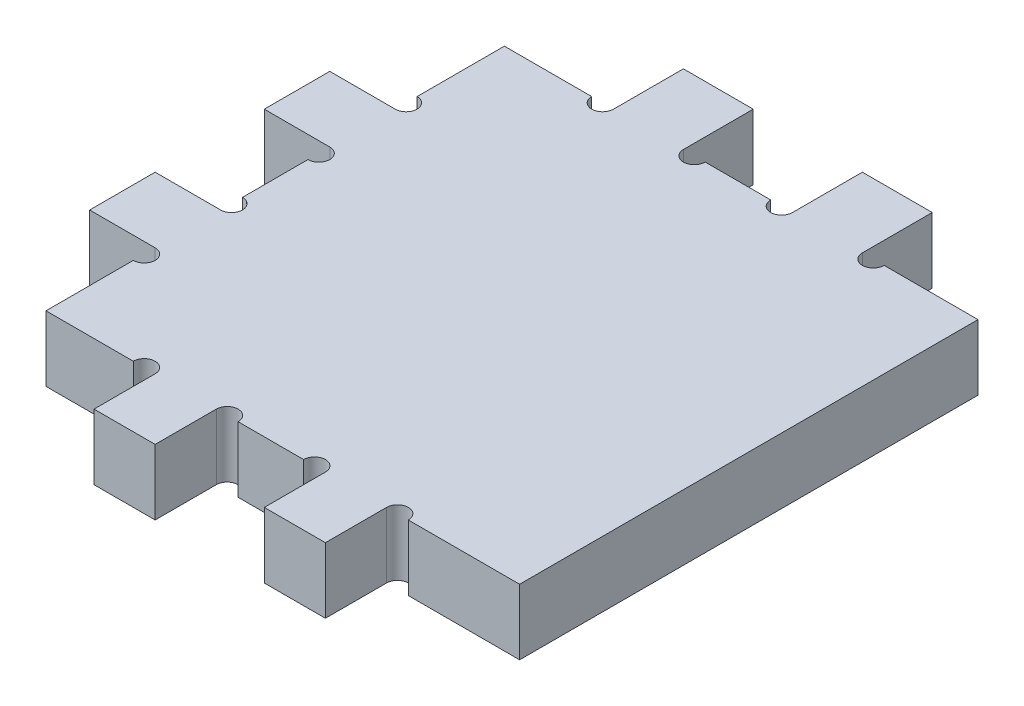
from build123d import *

# Parameters (mm, degrees)
BOSS_EXTRUDE1_DEPTH = 19.05


with BuildPart() as part:
    # Sketch1 → Boss-Extrude1 (new body)
    with BuildSketch(Plane(origin=(0, 0, 0), x_dir=(1, 0, 0), z_dir=(0, 1, 0))):
        with BuildLine():
            Line((-31.75, 39.558423237), (-50.8, 39.558423237))
            Line((-50.8, 39.558423237), (-50.8, 20.508423237))
            Line((-50.8, 20.508423237), (-31.75, 20.508423237))
            ThreePointArc((-31.75, 20.508423237), (-28.575, 17.333423237), (-31.75, 14.158423237))
            Line((-31.75, 14.158423237), (-31.75, -4.891576763))
            ThreePointArc((-31.75, -4.891576763), (-28.575, -8.066576763), (-31.75, -11.241576763))
            Line((-31.75, -11.241576763), (-50.8, -11.241576763))
            Line((-50.8, -11.241576763), (-50.8, -30.291576763))
            Line((-50.8, -30.291576763), (-31.75, -30.291576763))
            ThreePointArc((-31.75, -30.291576763), (-28.575, -33.466576763), (-31.75, -36.641576763))
            Line((-31.75, -36.641576763), (-31.75, -62.041576763))
            Line((-31.75, -62.041576763), (-6.35, -62.041576763))
            ThreePointArc((-6.35, -62.041576763), (-3.175, -58.866576763), (0, -62.041576763))
            Line((0, -62.041576763), (0, -79.821576763))
            Line((0, -79.821576763), (17.78, -79.821576763))
            Line((17.78, -79.821576763), (17.78, -62.041576763))
            ThreePointArc((17.78, -62.041576763), (20.955, -58.866576763), (24.13, -62.041576763))
            Line((24.13, -62.041576763), (43.18, -62.041576763))
            ThreePointArc((43.18, -62.041576763), (46.355, -58.866576763), (49.53, -62.041576763))
            Line((49.53, -62.041576763), (49.53, -79.821576763))
            Line((49.53, -79.821576763), (67.31, -79.821576763))
            Line((67.31, -79.821576763), (67.31, -62.041576763))
            ThreePointArc((67.31, -62.041576763), (70.485, -58.866576763), (73.66, -62.041576763))
            Line((73.66, -62.041576763), (106.027076755, -62.041576763))
            Line((106.027076755, -62.041576763), (106.027076755, 71.308423237))
            Line((106.027076755, 71.308423237), (78.74, 71.308423237))
            ThreePointArc((78.74, 71.308423237), (75.565, 68.133423237), (72.39, 71.308423237))
            Line((72.39, 71.308423237), (72.39, 91.628423237))
            Line((72.39, 91.628423237), (52.07, 91.628423237))
            Line((52.07, 91.628423237), (52.07, 71.308423237))
            ThreePointArc((52.07, 71.308423237), (48.895, 68.133423237), (45.72, 71.308423237))
            Line((45.72, 71.308423237), (26.67, 71.308423237))
            ThreePointArc((26.67, 71.308423237), (23.495, 68.133423237), (20.32, 71.308423237))
            Line((20.32, 71.308423237), (20.32, 91.628423237))
            Line((20.32, 91.628423237), (0, 91.628423237))
            Line((0, 91.628423237), (0, 71.308423237))
            ThreePointArc((0, 71.308423237), (-3.175, 68.133423237), (-6.35, 71.308423237))
            Line((-6.35, 71.308423237), (-31.75, 71.308423237))
            Line((-31.75, 71.308423237), (-31.75, 45.908423237))
            ThreePointArc((-31.75, 45.908423237), (-28.575, 42.733423237), (-31.75, 39.558423237))
        make_face()
    extrude(amount=BOSS_EXTRUDE1_DEPTH)


solid = part.part
